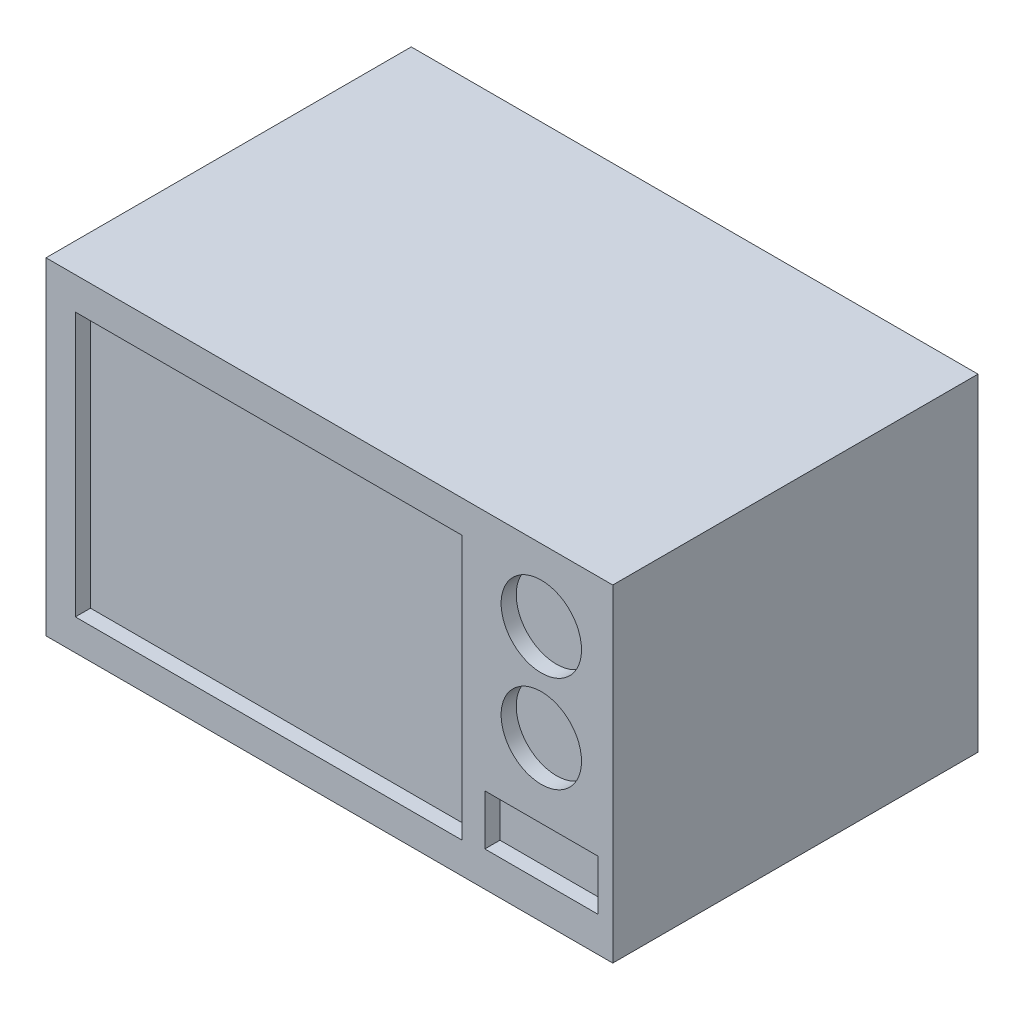
from build123d import *

# Parameters (mm, degrees)
SKETCH1_W           = 450
SKETCH1_H           = 290
BOSS_EXTRUDE1_DEPTH = 260
SKETCH2_R           = 31.915290565
SKETCH2_W           = 89.685507292
SKETCH2_H           = 39.972356382
SKETCH2_W_2         = 306.987697012
SKETCH2_H_2         = 209.632802358
CUT_EXTRUDE1_DEPTH  = 12


with BuildPart() as part:
    # Sketch1 → Boss-Extrude1 (new body)
    with BuildSketch(Plane(origin=(0, 0, 0), x_dir=(1, 0, 0), z_dir=(0, 1, 0))):
        Rectangle(SKETCH1_W, SKETCH1_H)
    extrude(amount=BOSS_EXTRUDE1_DEPTH)

    # Sketch2 → Cut-Extrude1 (cut)
    with BuildSketch(Plane.XY.offset(145)):
        with Locations((168.275900741, 203.066569732)):
            Circle(SKETCH2_R)
        with Locations((168.275900741, 126.418305405)):
            Circle(SKETCH2_R)
        with Locations((168.275900741, 47.697411123)):
            Rectangle(SKETCH2_W, SKETCH2_H)
        with Locations((-48.183132642, 129.533317372)):
            Rectangle(SKETCH2_W_2, SKETCH2_H_2)
    extrude(amount=-CUT_EXTRUDE1_DEPTH, mode=Mode.SUBTRACT)


solid = part.part
